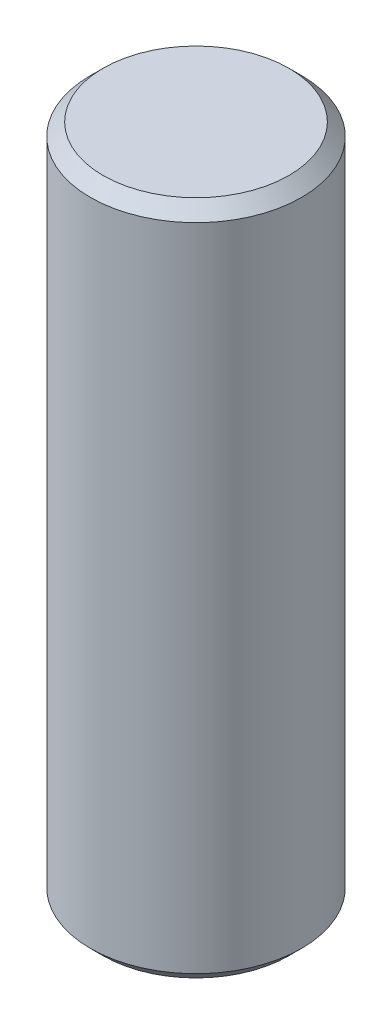
from build123d import *

# Parameters (mm, degrees)
SKETCH1_R           = 2.5
BOSS_EXTRUDE1_DEPTH = 16
CHAMFER1_SIZE       = 0.3


with BuildPart() as part:
    # Sketch1 → Boss-Extrude1 (new body)
    with BuildSketch(Plane(origin=(0, 0, 0), x_dir=(1, 0, 0), z_dir=(0, 1, 0))):
        with Locations(Location((0, 0, 0), (0, 0, 270))):
            Circle(SKETCH1_R)
    extrude(amount=BOSS_EXTRUDE1_DEPTH)

    # Chamfer1
    chamfer1_edges = [part.edges().sort_by_distance(p)[0] for p in [
        (0, 0, -2.5),
        (0, 16, -2.5),
    ]]
    chamfer(chamfer1_edges, length=CHAMFER1_SIZE)


solid = part.part
